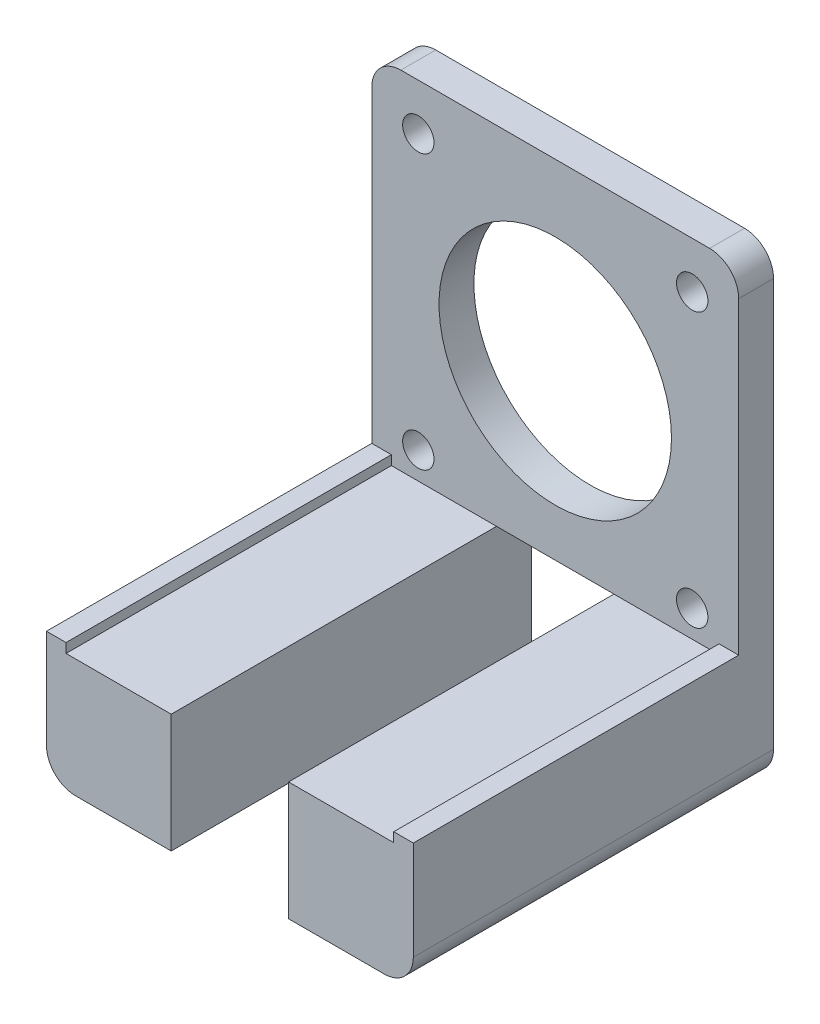
from build123d import *

# Parameters (mm, degrees)
CROQUIS1_R                   = 2.7
CROQUIS1_R_2                 = 20
SALIENTE_EXTRUIR1_DEPTH      = 6
SALIENTE_EXTRUIR2_DEPTH      = 56
SALIENTE_EXTRUIR2_DEPTH_BACK = 6
CROQUIS3_W                   = 20.2
CROQUIS3_H                   = 20.4
CORTAR_EXTRUIR1_DEPTH        = 110.967852121


with BuildPart() as part:
    # Croquis1 → Saliente-Extruir1 (new body)
    with BuildSketch(Plane.XY):
        with BuildLine():
            Line((-8, -50.14), (-8, 3))
            ThreePointArc((-8, 3), (-6.535533906, 6.535533906), (-3, 8))
            Line((-3, 8), (50.14, 8))
            ThreePointArc((50.14, 8), (53.675533906, 6.535533906), (55.14, 3))
            Line((55.14, 3), (55.14, -50.14))
            ThreePointArc((55.14, -50.14), (53.675533906, -53.675533906), (50.14, -55.14))
            Line((50.14, -55.14), (-3, -55.14))
            ThreePointArc((-3, -55.14), (-6.535533906, -53.675533906), (-8, -50.14))
        make_face()
        Circle(CROQUIS1_R, mode=Mode.SUBTRACT)
        with Locations((47.14, 0)):
            Circle(CROQUIS1_R, mode=Mode.SUBTRACT)
        with Locations((47.14, -47.14)):
            Circle(CROQUIS1_R, mode=Mode.SUBTRACT)
        with Locations((0, -47.14)):
            Circle(CROQUIS1_R, mode=Mode.SUBTRACT)
        with Locations((23.57, -23.57)):
            Circle(CROQUIS1_R_2, mode=Mode.SUBTRACT)
    extrude(amount=SALIENTE_EXTRUIR1_DEPTH)

    # Croquis2 → Saliente-Extruir2 (add, two sides: drawn at the far end of the back side and taken through both)
    with BuildSketch(Plane.XY.offset(6).offset(-SALIENTE_EXTRUIR2_DEPTH_BACK)):
        with BuildLine():
            ThreePointArc((-3, -55.14), (-6.535533906, -53.675533906), (-8, -50.14))
            Line((-8, -50.14), (-8, -67.17))
            ThreePointArc((-8, -67.17), (-6.535533906, -70.705533906), (-3, -72.17))
            Line((-3, -72.17), (13.47, -72.17))
            Line((13.47, -72.17), (13.47, -55.14))
            Line((13.47, -55.14), (-3, -55.14))
        make_face()
        with BuildLine():
            Line((55.14, -67.17), (55.14, -50.14))
            ThreePointArc((55.14, -50.14), (53.675533906, -53.675533906), (50.14, -55.14))
            Line((50.14, -55.14), (33.67, -55.14))
            Line((33.67, -55.14), (33.67, -72.17))
            Line((33.67, -72.17), (50.14, -72.17))
            ThreePointArc((50.14, -72.17), (53.675533906, -70.705533906), (55.14, -67.17))
        make_face()
        with BuildLine():
            Line((13.47, -51.77), (-4.63, -51.77))
            Line((-4.63, -51.77), (-4.63, -50.14))
            Line((-4.63, -50.14), (-8, -50.14))
            ThreePointArc((-8, -50.14), (-6.535533906, -53.675533906), (-3, -55.14))
            Line((-3, -55.14), (13.47, -55.14))
            Line((13.47, -55.14), (13.47, -51.77))
        make_face()
        with BuildLine():
            Line((55.14, -50.14), (51.77, -50.14))
            Line((51.77, -50.14), (51.77, -51.77))
            Line((51.77, -51.77), (33.67, -51.77))
            Line((33.67, -51.77), (33.67, -55.14))
            Line((33.67, -55.14), (50.14, -55.14))
            ThreePointArc((50.14, -55.14), (53.675533906, -53.675533906), (55.14, -50.14))
        make_face()
    extrude(amount=SALIENTE_EXTRUIR2_DEPTH + SALIENTE_EXTRUIR2_DEPTH_BACK)

    # Croquis3 → Cortar-Extruir1 (cut, through all)
    with BuildSketch(Plane.XY.offset(62)):
        with Locations((23.57, -61.97)):
            Rectangle(CROQUIS3_W, CROQUIS3_H)
    extrude(amount=-CORTAR_EXTRUIR1_DEPTH, mode=Mode.SUBTRACT)


solid = part.part
